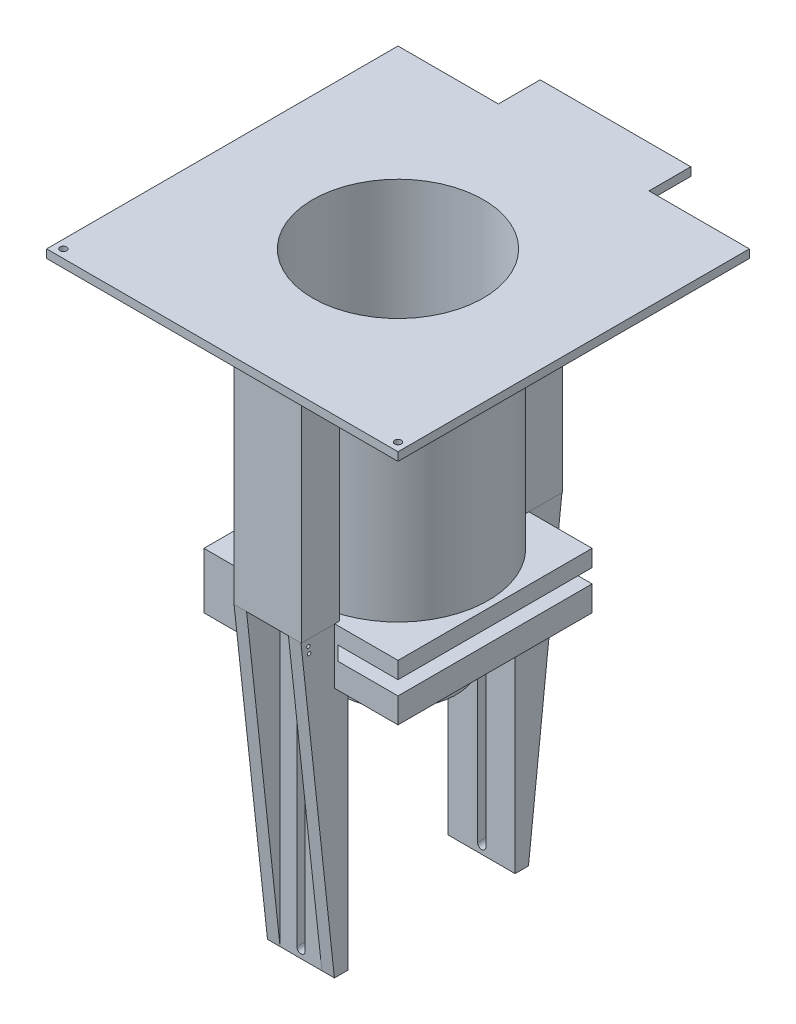
from build123d import *

# Parameters (mm, degrees)
SKETCH4_W                      = 116
SKETCH4_H                      = 116
BOSS_EXTRUDE1_DEPTH            = 10
SKETCH6_R                      = 33.5
CUT_EXTRUDE1_DEPTH             = 83.63171304
BOSS_EXTRUDE3_DEPTH            = 8.4
SKETCH10_W                     = 116
SKETCH10_H                     = 116
BOSS_EXTRUDE5_DEPTH            = 15
SKETCH11_R                     = 4
POSITIONING_HOLE_DEPTH         = 28
SKETCH23_R                     = 4
SNAPPING_HOLE_DEPTH            = 28
SKETCH13_R                     = 34.75
SKETCH13_R_2                   = 33.5
BOSS_EXTRUDE6_DEPTH            = 25
SKETCH24_W                     = 40
SKETCH24_H                     = 8
BOSS_EXTRUDE7_DEPTH            = 150
BOSS_EXTRUDE9_DEPTH            = 40
CUT_EXTRUDE6_DEPTH             = 8
CUT_EXTRUDE6_DIRECTION_2_REACH = 229.876
CUT_EXTRUDE7_REACH             = 225.194
CUT_EXTRUDE9_REACH             = 209.566
SKETCH37_W                     = 25
SKETCH37_H                     = 20
SKETCH12_R                     = 33.5
MAIN_HOLE_DEPTH                = 179.740034687
SKETCH42_R                     = 54
SKETCH42_R_2                   = 51
BOSS_EXTRUDE12_DEPTH           = 150
CHAMFER3_SIZE                  = 5
SKETCH44_W                     = 40.182717611
SKETCH44_H                     = 23
BOSS_EXTRUDE15_DEPTH           = 150
SKETCH41_R                     = 2
BOSS_EXTRUDE11_DEPTH           = 5
CUT_EXTRUDE12_START            = -150
SKETCH45_R                     = 51
CUT_EXTRUDE12_DEPTH            = 150
SKETCH46_R                     = 1
CUT_EXTRUDE13_DEPTH            = 25


with BuildPart() as part:
    # Sketch4 → Boss-Extrude1 (new body)
    with BuildSketch(Plane(origin=(0, 0, 0), x_dir=(1, 0, 0), z_dir=(0, 1, 0))):
        Rectangle(SKETCH4_W, SKETCH4_H)
    extrude(amount=BOSS_EXTRUDE1_DEPTH)

    # Sketch6 → Cut-Extrude1 (cut, through all)
    with BuildSketch(Plane(origin=(0, 10, 0), x_dir=(1, 0, 0), z_dir=(0, 1, 0))):
        with Locations(Location((0, 0, 0), (0, 0, 270))):
            Circle(SKETCH6_R)
    extrude(amount=-CUT_EXTRUDE1_DEPTH, mode=Mode.SUBTRACT)

    # Sketch8 → Boss-Extrude3 (add)
    with BuildSketch(Plane.XZ):
        with BuildLine():
            Line((-58, 58), (-58, -58))
            Line((-58, -58), (22, -58))
            ThreePointArc((22, -58), (-36, 0), (22, 58))
            Line((22, 58), (-58, 58))
        make_face()
    extrude(amount=BOSS_EXTRUDE3_DEPTH)

    # Sketch10 → Boss-Extrude5 (add)
    with BuildSketch(Plane.XZ.offset(8.4)):
        Rectangle(SKETCH10_W, SKETCH10_H)
    extrude(amount=BOSS_EXTRUDE5_DEPTH)

    # Sketch11 → positioning hole (cut)
    with BuildSketch(Plane.XZ.offset(23.4)):
        with Locations(Location((39, 0, 0), (0, 0, 270))):
            Circle(SKETCH11_R)
    extrude(amount=-POSITIONING_HOLE_DEPTH, mode=Mode.SUBTRACT)

    # Sketch23 → snapping hole (cut)
    with BuildSketch(Plane.XZ.offset(23.4)):
        with Locations(Location((38.947036647, 20, 0), (0, 0, 270))):
            Circle(SKETCH23_R)
    extrude(amount=-SNAPPING_HOLE_DEPTH, mode=Mode.SUBTRACT)

    # Sketch13 → Boss-Extrude6 (add)
    with BuildSketch(Plane.XZ.offset(23.4)):
        with Locations(Location((0, 0, 0), (0, 0, 270))):
            Circle(SKETCH13_R)
        with Locations(Location((0, 0, 0), (0, 0, 90))):
            Circle(SKETCH13_R_2, mode=Mode.SUBTRACT)
    extrude(amount=BOSS_EXTRUDE6_DEPTH)

    # Sketch24 → Boss-Extrude7 (add)
    with BuildSketch(Plane.XZ.offset(23.4)):
        with Locations((0, 54)):
            Rectangle(SKETCH24_W, SKETCH24_H)
        with Locations((0, -54)):
            Rectangle(SKETCH24_W, SKETCH24_H)
    extrude(amount=BOSS_EXTRUDE7_DEPTH)

    # Sketch28 → Boss-Extrude9 (add)
    with BuildSketch(Plane.ZY.offset(20)):
        Polygon((-58, -173.4), (-58, 10), (-78, 10), align=None)
        Polygon((58, 10), (58, -173.4), (78, 10), align=None)
    extrude(amount=-BOSS_EXTRUDE9_DEPTH)

    # Sketch31 → Cut-Extrude6 (cut)
    with BuildSketch(Plane(origin=(0, 0, -58), x_dir=(-1, 0, 0), z_dir=(0, 0, -1))):
        with BuildLine():
            Line((2.5, -28.4), (2.5, -168.4))
            ThreePointArc((2.5, -168.4), (0, -170.9), (-2.5, -168.4))
            Line((-2.5, -168.4), (-2.5, -28.4))
            ThreePointArc((-2.5, -28.4), (0, -25.9), (2.5, -28.4))
        make_face()
    extrude(amount=-CUT_EXTRUDE6_DEPTH, mode=Mode.SUBTRACT)

    # Cut-Extrude6 direction 2: up to this plane
    cut_extrude6_direction_2_end = Plane(origin=(20, 10, -78), z_dir=(0, -0.1084085524287415, -0.9941064257715594))
    # Sketch31 → Cut-Extrude6 direction 2 (cut, up to the surface)
    with BuildSketch(Plane(origin=(0, 0, -58), x_dir=(-1, 0, 0), z_dir=(0, 0, -1)), mode=Mode.PRIVATE) as cut_extrude6_direction_2_sk1:
        with BuildLine():
            Line((2.5, -28.4), (2.5, -168.4))
            ThreePointArc((2.5, -168.4), (0, -170.9), (-2.5, -168.4))
            Line((-2.5, -168.4), (-2.5, -28.4))
            ThreePointArc((-2.5, -28.4), (0, -25.9), (2.5, -28.4))
        make_face()
    cut_extrude6_direction_2_tool1 = split(extrude(cut_extrude6_direction_2_sk1.sketch, amount=CUT_EXTRUDE6_DIRECTION_2_REACH, mode=Mode.PRIVATE), bisect_by=cut_extrude6_direction_2_end, keep=Keep.BOTH, mode=Mode.PRIVATE)
    add(cut_extrude6_direction_2_tool1.solids().sort_by_distance((0, -98.4, -58))[0], mode=Mode.SUBTRACT)

    # Cut-Extrude7: up to this plane
    cut_extrude7_end = Plane(origin=(20, -173.4, 58), z_dir=(0, -0.1084085524287415, 0.9941064257715594))
    # Sketch34 → Cut-Extrude7 (cut, up to the surface)
    with BuildSketch(Plane(origin=(0, 0, 50), x_dir=(-1, 0, 0), z_dir=(0, 0, -1)), mode=Mode.PRIVATE) as cut_extrude7_sk1:
        with BuildLine():
            Line((-2.5, -28.4), (-2.5, -168.4))
            ThreePointArc((-2.5, -168.4), (0, -170.9), (2.5, -168.4))
            Line((2.5, -168.4), (2.5, -28.4))
            ThreePointArc((2.5, -28.4), (0, -25.9), (-2.5, -28.4))
        make_face()
    cut_extrude7_tool1 = split(extrude(cut_extrude7_sk1.sketch, amount=-CUT_EXTRUDE7_REACH, mode=Mode.PRIVATE), bisect_by=cut_extrude7_end, keep=Keep.BOTH, mode=Mode.PRIVATE)
    add(cut_extrude7_tool1.solids().sort_by_distance((0, -98.4, 50))[0], mode=Mode.SUBTRACT)

    # Sketch37 → Cut-Extrude9 (cut, up to next)
    with BuildSketch(Plane(origin=(0, 10, 0), x_dir=(1, 0, 0), z_dir=(0, 1, 0)), mode=Mode.PRIVATE) as cut_extrude9_sk1:
        with Locations((0, 68)):
            Rectangle(SKETCH37_W, SKETCH37_H)
    cut_extrude9_tool1 = extrude(cut_extrude9_sk1.sketch, amount=-CUT_EXTRUDE9_REACH, mode=Mode.PRIVATE) & part.part
    # Sketch37 → Cut-Extrude9 (cut, up to next)
    with BuildSketch(Plane(origin=(0, 10, 0), x_dir=(1, 0, 0), z_dir=(0, 1, 0)), mode=Mode.PRIVATE) as cut_extrude9_sk2:
        with Locations((0, -68)):
            Rectangle(SKETCH37_W, SKETCH37_H)
    cut_extrude9_tool2 = extrude(cut_extrude9_sk2.sketch, amount=-CUT_EXTRUDE9_REACH, mode=Mode.PRIVATE) & part.part
    add(cut_extrude9_tool1.solids().sort_by_distance((0, 10, -68))[0], mode=Mode.SUBTRACT)
    add(cut_extrude9_tool2.solids().sort_by_distance((0, 10, 68))[0], mode=Mode.SUBTRACT)

    # Sketch12 → main hole (cut, through all)
    with BuildSketch(Plane.XZ.offset(23.4)):
        with Locations(Location((0, 0, 0), (0, 0, 90))):
            Circle(SKETCH12_R)
    extrude(amount=-MAIN_HOLE_DEPTH, mode=Mode.SUBTRACT)

    # Sketch42 → Boss-Extrude12 (add)
    with BuildSketch(Plane(origin=(0, 10, 0), x_dir=(1, 0, 0), z_dir=(0, 1, 0))):
        with Locations(Location((0, 0, 0), (0, 0, 270))):
            Circle(SKETCH42_R)
        with Locations(Location((0, 0, 0), (0, 0, 270))):
            Circle(SKETCH42_R_2, mode=Mode.SUBTRACT)
    extrude(amount=BOSS_EXTRUDE12_DEPTH)

    # Chamfer3
    chamfer3_edges = [part.edges().sort_by_distance(p)[0] for p in [
        (0, 10, -33.5),
    ]]
    chamfer(chamfer3_edges, length=CHAMFER3_SIZE)

    # Sketch44 → Boss-Extrude15 (add)
    with BuildSketch(Plane(origin=(0, 10, 0), x_dir=(1, 0, 0), z_dir=(0, 1, 0))):
        with Locations((0.091358806, 66.5)):
            Rectangle(SKETCH44_W, SKETCH44_H)
        with Locations((0.091358806, -66.5)):
            Rectangle(SKETCH44_W, SKETCH44_H)
    extrude(amount=BOSS_EXTRUDE15_DEPTH)

    # Sketch41 → Boss-Extrude11 (add)
    with BuildSketch(Plane(origin=(0, 160, 0), x_dir=(1, 0, 0), z_dir=(0, 1, 0))):
        Polygon((45, 105), (105, 105), (105, -105), (-105, -105), (-105, 105), (-45, 105), (-45, 130), (45, 130), align=None)
        with Locations(Location((-100, -100, 0), (0, 0, 270))):
            Circle(SKETCH41_R, mode=Mode.SUBTRACT)
        with Locations(Location((100, -100, 0), (0, 0, 270))):
            Circle(SKETCH41_R, mode=Mode.SUBTRACT)
    extrude(amount=BOSS_EXTRUDE11_DEPTH)

    # Sketch45 → Cut-Extrude12 (cut)
    with BuildSketch(Plane(origin=(0, 165, 0), x_dir=(1, 0, 0), z_dir=(0, 1, 0)).offset(CUT_EXTRUDE12_START)):
        with Locations(Location((0, 0, 0), (0, 0, 270))):
            Circle(SKETCH45_R)
    extrude(amount=CUT_EXTRUDE12_DEPTH, mode=Mode.SUBTRACT)

    # Sketch46 → Cut-Extrude13 (cut)
    with BuildSketch(Plane(origin=(20, 0, 0), x_dir=(0, 0, -1), z_dir=(1, 0, 0))):
        with Locations((-73.540080926, 6)):
            Circle(SKETCH46_R)
        with Locations((-73.10387591, 2)):
            Circle(SKETCH46_R)
    extrude(amount=-CUT_EXTRUDE13_DEPTH, mode=Mode.SUBTRACT)


solid = part.part
